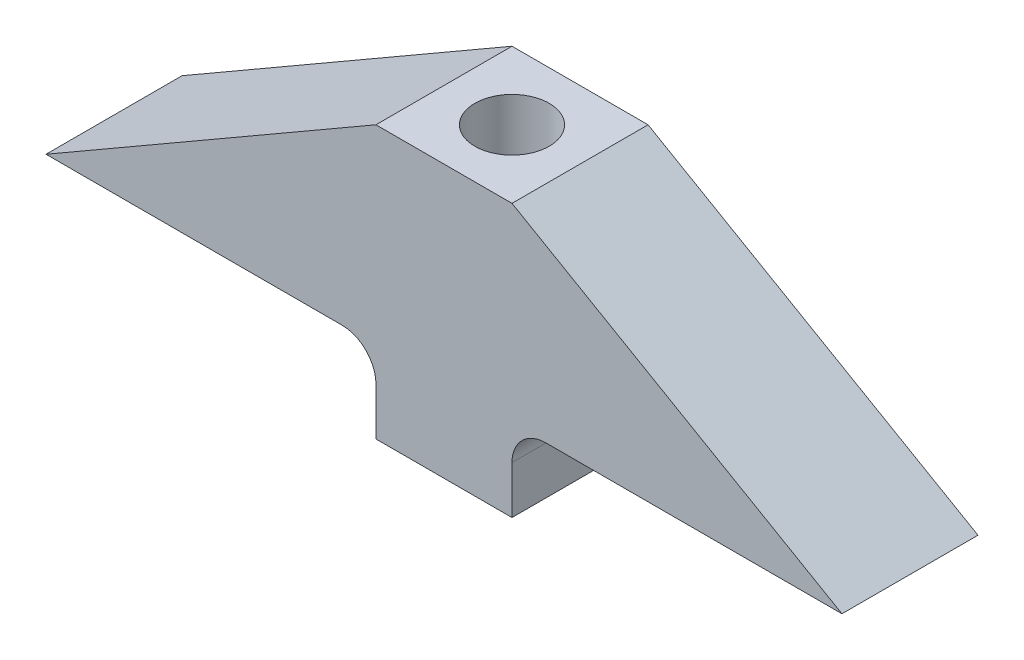
from build123d import *

# Parameters (mm, degrees)
BOSS_EXTRUDE1_DEPTH                  = 25.4
F_35_64_0_54688_DIAMETER_HOLE1_D     = 13.890752
F_35_64_0_54688_DIAMETER_HOLE1_DEPTH = 35.052
F_35_64_0_54688_DIAMETER_HOLE1_TIP   = 4.173202923
F_10_32_TAPPED_HOLE1_D               = 4.0386
F_10_32_TAPPED_HOLE1_DEPTH           = 8.636
F_10_32_TAPPED_HOLE1_TIP             = 1.213317848
FILLET1_R                            = 6.35


with BuildPart() as part:
    # Sketch1 → Boss-Extrude1 (new body)
    with BuildSketch(Plane.XY):
        Polygon((0, 0), (61.591726717, 0), (61.591726717, -15.24), (86.991726717, -15.24), (86.991726717, 0), (148.583453434, 0), (86.991726717, 35.56), (61.591726717, 35.56), align=None)
    extrude(amount=BOSS_EXTRUDE1_DEPTH)

    # 35/64 (0.54688) Diameter Hole1
    with Locations(Plane(origin=(0, 35.56, 0), x_dir=(1, 0, 0), z_dir=(0, 1, 0))):
        with Locations((74.291726717, -12.7)):
            Hole(F_35_64_0_54688_DIAMETER_HOLE1_D / 2, depth=F_35_64_0_54688_DIAMETER_HOLE1_DEPTH)
            with Locations((0, 0, -(F_35_64_0_54688_DIAMETER_HOLE1_DEPTH + F_35_64_0_54688_DIAMETER_HOLE1_TIP / 2))):  # 118° drill point
                Cone(0, F_35_64_0_54688_DIAMETER_HOLE1_D / 2, F_35_64_0_54688_DIAMETER_HOLE1_TIP, mode=Mode.SUBTRACT)

    # #10-32 Tapped Hole1
    with Locations(Plane(origin=(0, -15.24, 0), x_dir=(-1, 0, 0), z_dir=(0, -1, 0))):
        with Locations((-77.466726717, -15.875), (-71.116726717, -9.525)):
            Hole(F_10_32_TAPPED_HOLE1_D / 2, depth=F_10_32_TAPPED_HOLE1_DEPTH)
            with Locations((0, 0, -(F_10_32_TAPPED_HOLE1_DEPTH + F_10_32_TAPPED_HOLE1_TIP / 2))):  # 118° drill point
                Cone(0, F_10_32_TAPPED_HOLE1_D / 2, F_10_32_TAPPED_HOLE1_TIP, mode=Mode.SUBTRACT)

    # Fillet1
    fillet1_edges = [part.edges().sort_by_distance(p)[0] for p in [
        (86.991726717, 0, 12.7),
        (61.591726717, 0, 12.7),
    ]]
    fillet(fillet1_edges, radius=FILLET1_R)


solid = part.part
